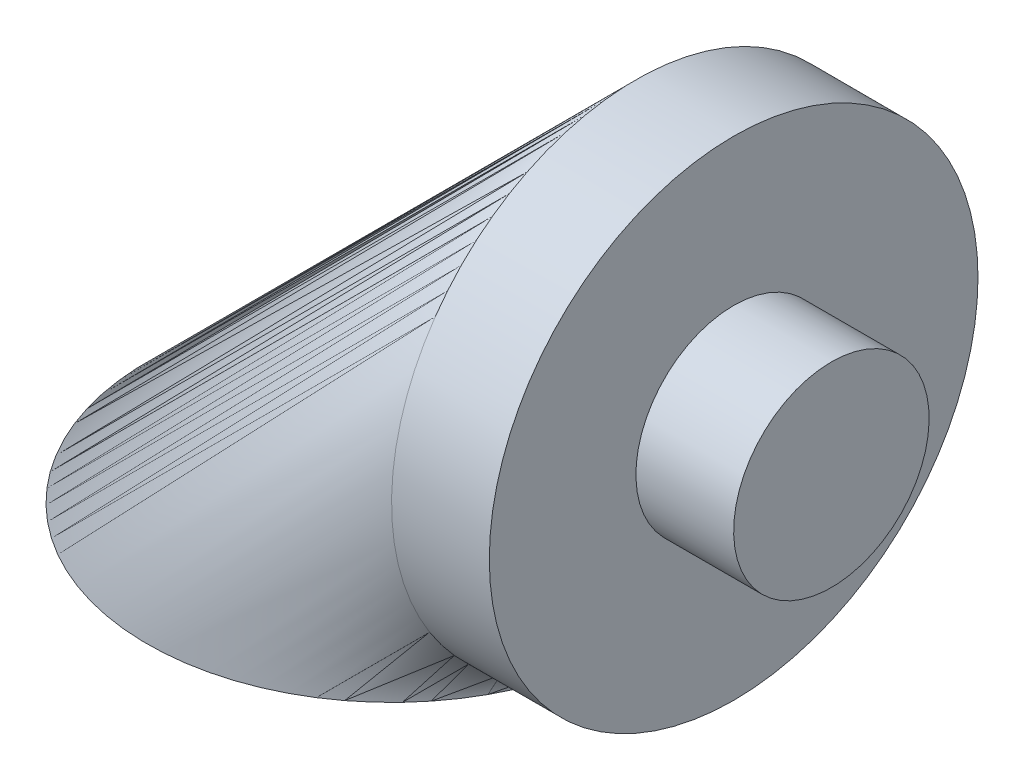
from build123d import *

# Parameters (mm, degrees)
SKETCH1_R           = 50
SKETCH4_R           = 20
BOSS_EXTRUDE2_DEPTH = 20
SKETCH5_R           = 50
BOSS_EXTRUDE3_DEPTH = 20
SKETCH6_R           = 20
BOSS_EXTRUDE4_DEPTH = 20


with BuildPart() as part:
    # Sweep1: sweep along a path in Sketch2
    with BuildLine(Plane.XY) as sweep1_path:
        ThreePointArc((50, 50), (14.644660941, 35.355339059), (0, 0))
    # Sketch1 → Sweep1 (sweep)
    with BuildSketch(Plane(origin=(0, 0, 0), x_dir=(1, 0, 0), z_dir=(0, 1, 0))):
        Circle(SKETCH1_R)
    sweep(path=sweep1_path.line)

    # Sketch4 → Boss-Extrude2 (add)
    with BuildSketch(Plane.XZ):
        with Locations(Location((0, 0, 0), (0, 0, 270))):
            Circle(SKETCH4_R)
    extrude(amount=BOSS_EXTRUDE2_DEPTH)

    # Sketch5 → Boss-Extrude3 (add)
    with BuildSketch(Plane(origin=(50, 0, 0), x_dir=(0, 0, -1), z_dir=(1, 0, 0))):
        with Locations(Location((0, 50, 0), (0, 0, 270))):
            Circle(SKETCH5_R)
    extrude(amount=BOSS_EXTRUDE3_DEPTH)

    # Sketch6 → Boss-Extrude4 (add)
    with BuildSketch(Plane(origin=(70, 0, 0), x_dir=(0, 0, -1), z_dir=(1, 0, 0))):
        with Locations(Location((0, 50, 0), (0, 0, 90))):
            Circle(SKETCH6_R)
    extrude(amount=BOSS_EXTRUDE4_DEPTH)


solid = part.part
